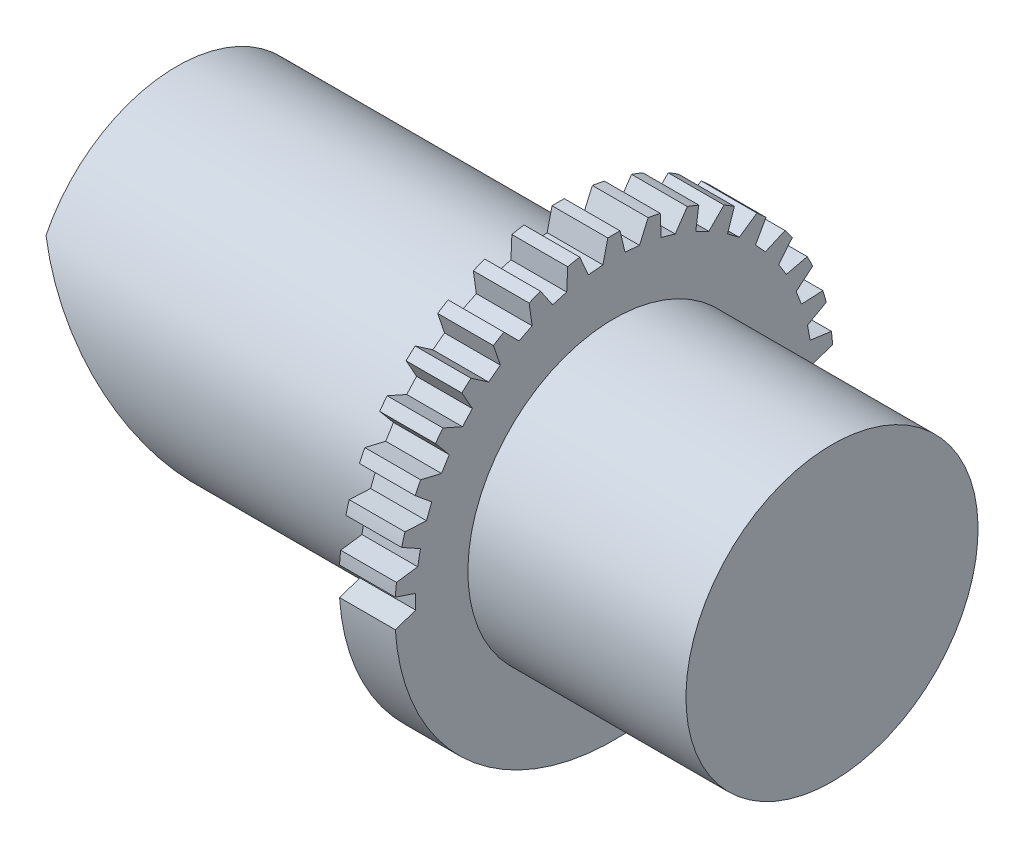
from build123d import *

# Parameters (mm, degrees)
CUT_EXTRUDE1_DEPTH      = 86.450904972
CIRPATTERN1_COUNT       = 18
CIRPATTERN1_ANGLE       = 180
CUT_EXTRUDE2_DEPTH      = 94.149359325
CUT_EXTRUDE2_DEPTH_BACK = 94.149359325
BOSS_EXTRUDE1_DEPTH     = 3.81
CUT_EXTRUDE4_DEPTH      = 100.573936521
CUT_EXTRUDE4_DEPTH_BACK = 100.573936521
SKETCH9_R               = 6.35


with BuildPart() as part:
    # Sketch2 → Revolve1 (revolve)
    with BuildSketch(Plane(origin=(0, 0, 0), x_dir=(0, 1, 0), z_dir=(0, 0, 1))):
        Polygon((0, -37.923611111), (-25.4, -37.923611111), (-25.4, 0), (-38.1, 0), (-38.1, 9.701388889), (-25.4, 9.701388889), (-25.4, 76.023611111), (0, 76.023611111), align=None)
    revolve(axis=Axis((-76.023611111, 0, 0), (1, 0, 0)))

    # Sketch3 → Cut-Extrude1 (cut, through all)
    with BuildSketch(Plane(origin=(-9.701388889, 0, 0), x_dir=(0, -1, 0), z_dir=(-1, 0, 0))):
        Polygon((0, 38.288766927), (2.54, 38.288766927), (1.27, 34.478766927), (0, 34.478766927), (-1.27, 34.478766927), (-2.54, 38.288766927), align=None)
    cut_extrude1 = extrude(amount=-CUT_EXTRUDE1_DEPTH, mode=Mode.SUBTRACT)

    # CirPattern1: Cut-Extrude1 ×18 about axis
    cirpattern1_axis = Axis((0, 0, 0), (-1, 0, 0))
    for i in range(1, CIRPATTERN1_COUNT):
        add(cut_extrude1.rotate(cirpattern1_axis, i * CIRPATTERN1_ANGLE / (CIRPATTERN1_COUNT - 1)), mode=Mode.SUBTRACT)

    # Sketch5 → Cut-Extrude2 (cut, two sides: drawn at the far end of the back side and taken through both)
    with BuildSketch(Plane(origin=(0, 0, 0), x_dir=(0, 1, 0), z_dir=(0, 0, 1)).offset(-CUT_EXTRUDE2_DEPTH_BACK)):
        Polygon((11.291183517, 76.023611111), (-25.4, 76.023611111), (-25.4, 49.536195496), align=None)
    extrude(amount=CUT_EXTRUDE2_DEPTH + CUT_EXTRUDE2_DEPTH_BACK, mode=Mode.SUBTRACT)

    # Sketch7 → Boss-Extrude1 (add, symmetric)
    with BuildSketch(Plane(origin=(0, 0, 0), x_dir=(0, 1, 0), z_dir=(0, 0, 1))):
        with BuildLine():
            Line((0, 67.872490271), (-7.374879009, 78.211791969))
            ThreePointArc((-7.374879009, 78.211791969), (-19.941931013, 80.231629124), (-21.978787639, 67.667324397))
            Line((-21.978787639, 67.667324397), (-14.376066372, 57.494388275))
            Line((-14.376066372, 57.494388275), (-7.054408242, 62.779903303))
            Line((-7.054408242, 62.779903303), (0, 67.872490271))
        make_face()
    extrude(amount=BOSS_EXTRUDE1_DEPTH, both=True)

    # Sketch9 → Cut-Extrude4 (cut, two sides: drawn at the far end of the back side and taken through both)
    with BuildSketch(Plane.XY.offset(3.81).offset(-CUT_EXTRUDE4_DEPTH_BACK)):
        with Locations((-72.929668111, -14.66969239)):
            Circle(SKETCH9_R)
    extrude(amount=CUT_EXTRUDE4_DEPTH + CUT_EXTRUDE4_DEPTH_BACK, mode=Mode.SUBTRACT)


solid = part.part
